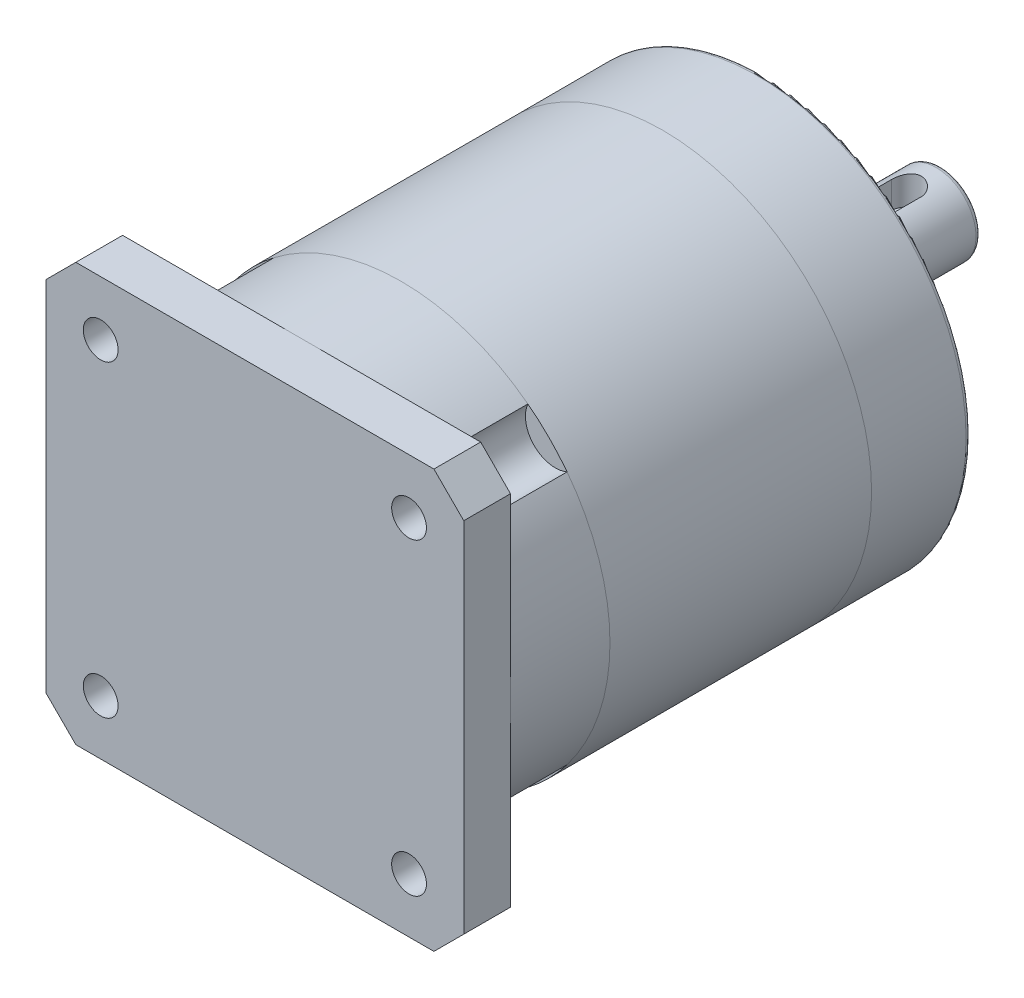
from build123d import *

# Parameters (mm, degrees)
BOSS_EXTRUDE1_DEPTH = 4.7
SKETCH2_R           = 21
BOSS_EXTRUDE2_DEPTH = 51
SKETCH3_R           = 4
BOSS_EXTRUDE3_DEPTH = 18
SKETCH5_R           = 1.75
CUT_EXTRUDE1_DEPTH  = 10
SKETCH6_R           = 3
CUT_EXTRUDE2_DEPTH  = 10
CUT_EXTRUDE3_DEPTH  = 3
FILLET1_R           = 0.5
SKETCH8_R           = 2
CUT_EXTRUDE4_DEPTH  = 10


with BuildPart() as part:
    # Sketch1 → Boss-Extrude1 (new body)
    with BuildSketch(Plane.XY):
        Polygon((-21, 18), (-18, 21), (18, 21), (21, 18), (21, -18), (18, -21), (-18, -21), (-21, -18), align=None)
    extrude(amount=BOSS_EXTRUDE1_DEPTH)

    # Sketch2 → Boss-Extrude2 (add)
    with BuildSketch(Plane.XY.offset(4.7)):
        Circle(SKETCH2_R)
    extrude(amount=-BOSS_EXTRUDE2_DEPTH)

    # Sketch3 → Boss-Extrude3 (add)
    with BuildSketch(Plane(origin=(0, 0, -46.3), x_dir=(-1, 0, 0), z_dir=(0, 0, -1))):
        Circle(SKETCH3_R)
    extrude(amount=BOSS_EXTRUDE3_DEPTH)

    # Sketch5 → Cut-Extrude1 (cut)
    with BuildSketch(Plane.XY.offset(4.7)):
        with Locations((-15.5, 15.5)):
            Circle(SKETCH5_R)
        with Locations((15.5, 15.5)):
            Circle(SKETCH5_R)
        with Locations((-15.5, -15.5)):
            Circle(SKETCH5_R)
        with Locations((15.5, -15.5)):
            Circle(SKETCH5_R)
    extrude(amount=-CUT_EXTRUDE1_DEPTH, mode=Mode.SUBTRACT)

    # Sketch6 → Cut-Extrude2 (cut)
    with BuildSketch(Plane(origin=(0, 0, 0), x_dir=(-1, 0, 0), z_dir=(0, 0, -1))):
        with Locations((-15.5, 15.5)):
            Circle(SKETCH6_R)
        with Locations((-15.5, -15.5)):
            Circle(SKETCH6_R)
        with Locations((15.5, -15.5)):
            Circle(SKETCH6_R)
        with Locations((15.5, 15.5)):
            Circle(SKETCH6_R)
    extrude(amount=CUT_EXTRUDE2_DEPTH, mode=Mode.SUBTRACT)

    # Sketch7 → Cut-Extrude3 (cut)
    with BuildSketch(Plane(origin=(0, 4, 0), x_dir=(1, 0, 0), z_dir=(0, 1, 0))):
        with BuildLine():
            Line((1.5, 60.8), (1.5, 49.8))
            ThreePointArc((1.5, 49.8), (0, 48.3), (-1.5, 49.8))
            Line((-1.5, 49.8), (-1.5, 60.8))
            ThreePointArc((-1.5, 60.8), (0, 62.3), (1.5, 60.8))
        make_face()
    extrude(amount=-CUT_EXTRUDE3_DEPTH, mode=Mode.SUBTRACT)

    # Fillet1
    fillet1_edges = [part.edges().sort_by_distance(p)[0] for p in [
        (-21, 0, -46.3),
        (4, 0, -64.3),
    ]]
    fillet(fillet1_edges, radius=FILLET1_R)

    # Sketch8 → Cut-Extrude4 (cut)
    with BuildSketch(Plane(origin=(0, 0, -46.3), x_dir=(-1, 0, 0), z_dir=(0, 0, -1))):
        with Locations((0, 17.5)):
            Circle(SKETCH8_R)
        with Locations((-17.5, 0)):
            Circle(SKETCH8_R)
        with Locations((0, -17.5)):
            Circle(SKETCH8_R)
        with Locations((17.5, 0)):
            Circle(SKETCH8_R)
    extrude(amount=-CUT_EXTRUDE4_DEPTH, mode=Mode.SUBTRACT)


solid = part.part
